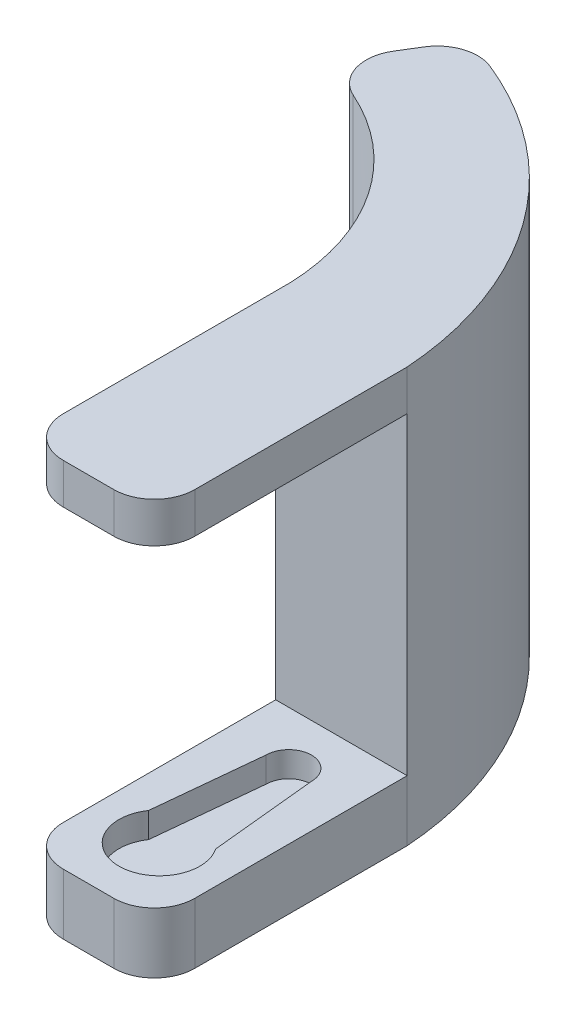
from build123d import *

# Parameters (mm, degrees)
SKETCH1_W           = 13
SKETCH1_H           = 25
BOSS_EXTRUDE1_DEPTH = 6
SKETCH2_W           = 13
SKETCH2_H           = 25
BOSS_EXTRUDE2_DEPTH = 4
CUT_EXTRUDE1_DEPTH  = 2.5
BOSS_EXTRUDE3_DEPTH = 41
CUT_EXTRUDE2_DEPTH  = 18
FILLET2_R           = 4
FILLET3_R           = 4


with BuildPart() as part:
    # Sketch1 → Boss-Extrude1 (new body)
    with BuildSketch(Plane(origin=(0, 0, 0), x_dir=(1, 0, 0), z_dir=(0, 1, 0))):
        with Locations((6.5, -12.5)):
            Rectangle(SKETCH1_W, SKETCH1_H)
    extrude(amount=BOSS_EXTRUDE1_DEPTH)

    # Sketch3 → Cut-Extrude1 (cut)
    with BuildSketch(Plane(origin=(0, 6, 0), x_dir=(1, 0, 0), z_dir=(0, 1, 0))):
        with BuildLine():
            Line((4.25, -5.207729985), (3.192810861, -15.75))
            ThreePointArc((3.192810861, -15.75), (6.5, -14), (9.807189139, -15.75))
            Line((9.807189139, -15.75), (8.75, -5.207729985))
            ThreePointArc((8.75, -5.207729985), (6.5, -2.957729985), (4.25, -5.207729985))
        make_face()
        with BuildLine():
            ThreePointArc((9.807189139, -15.75), (6.5, -14), (3.192810861, -15.75))
            Line((3.192810861, -15.75), (3.192810861, -20.25))
            ThreePointArc((3.192810861, -20.25), (6.5, -22), (9.807189139, -20.25))
            Line((9.807189139, -20.25), (9.807189139, -15.75))
        make_face()
        with BuildLine():
            Line((3.192810861, -20.25), (3.192810861, -15.75))
            ThreePointArc((3.192810861, -15.75), (2.5, -18), (3.192810861, -20.25))
        make_face()
        with BuildLine():
            ThreePointArc((10.5, -18), (10.322875656, -16.822875656), (9.807189139, -15.75))
            Line((9.807189139, -15.75), (9.807189139, -20.25))
            ThreePointArc((9.807189139, -20.25), (10.322875656, -19.177124344), (10.5, -18))
        make_face()
    extrude(amount=-CUT_EXTRUDE1_DEPTH, mode=Mode.SUBTRACT)



with BuildPart() as body_2:
    # Sketch2 → Boss-Extrude2 (new body)
    with BuildSketch(Plane(origin=(0, 37, 0), x_dir=(1, 0, 0), z_dir=(0, 1, 0))):
        with Locations((6.5, -12.5)):
            Rectangle(SKETCH2_W, SKETCH2_H)
    extrude(amount=BOSS_EXTRUDE2_DEPTH)


with BuildPart() as part_1:
    add(part.part)

    add(body_2.part)  # Boss-Extrude3 merges body 2
    # Sketch4 → Boss-Extrude3 (add, through all)
    with BuildSketch(Plane.XZ):
        with BuildLine():
            Line((-17.376544105, -22.043835706), (-11.894619464, -30.983507581))
            ThreePointArc((-11.894619464, -30.983507581), (5.405335132, -19.390755444), (13, 0))
            Line((13, 0), (0, 0))
            ThreePointArc((0, 0), (-4.675917284, -14.184745799), (-17.376544105, -22.043835706))
        make_face()
    extrude(amount=-BOSS_EXTRUDE3_DEPTH)

    # Sketch5 → Cut-Extrude2 (cut)
    with BuildSketch(Plane(origin=(0, 9, 0), x_dir=(-1, 0, 0), z_dir=(0, -1, 0))):
        with BuildLine():
            Line((1.720669879, 26.072760653), (7.3010615, 16.972513332))
            ThreePointArc((7.3010615, 16.972513332), (12.005611012, 20.170145468), (17.376544105, 22.043835706))
            Line((17.376544105, 22.043835706), (11.894619464, 30.983507581))
            ThreePointArc((11.894619464, 30.983507581), (6.607240555, 28.943325821), (1.720669879, 26.072760653))
        make_face()
    extrude(amount=-CUT_EXTRUDE2_DEPTH, mode=Mode.SUBTRACT)

    # Fillet2
    fillet2_edges = [part_1.edges().sort_by_distance(p)[0] for p in [
        (-17.376544105, 34, -22.043835706),
        (-11.894619464, 34, -30.983507581),
        (-17.376544105, 4.5, -22.043835706),
        (-11.894619464, 4.5, -30.983507581),
    ]]
    fillet(fillet2_edges, radius=FILLET2_R)

    # Fillet3
    fillet3_edges = [part_1.edges().sort_by_distance(p)[0] for p in [
        (0, 3, 25),
        (13, 3, 25),
        (13, 39, 25),
        (0, 39, 25),
    ]]
    fillet(fillet3_edges, radius=FILLET3_R)


solid = part_1.part
